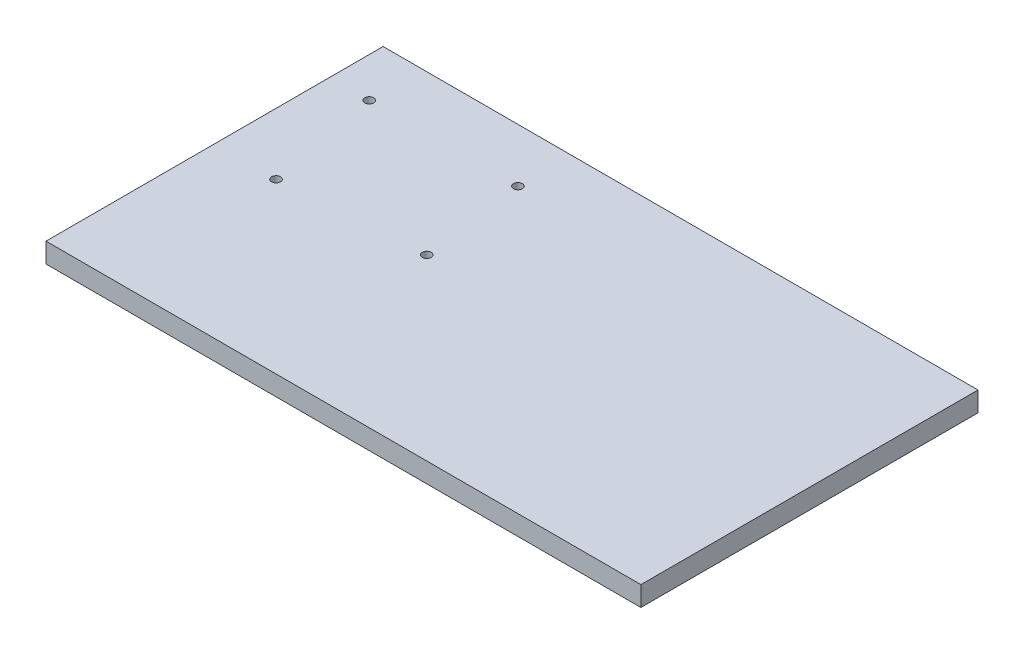
from build123d import *

# Parameters (mm, degrees)
SKETCH_1_W      = 300
SKETCH_1_H      = 170
SKETCH_1_R      = 2.25
EXTRUDE_1_DEPTH = 10


with BuildPart() as part:
    # Эскиз1 → Бобышка-Вытянуть1 (new body)
    with BuildSketch(Plane(origin=(0, 0, 0), x_dir=(1, 0, 0), z_dir=(0, 1, 0))):
        with Locations((150, 85)):
            Rectangle(SKETCH_1_W, SKETCH_1_H)
        with Locations(Location((20, 143, 0), (0, 0, 270))):
            Circle(SKETCH_1_R, mode=Mode.SUBTRACT)
        with Locations(Location((95, 143, 0), (0, 0, 270))):
            Circle(SKETCH_1_R, mode=Mode.SUBTRACT)
        with Locations(Location((102, 90, 0), (0, 0, 270))):
            Circle(SKETCH_1_R, mode=Mode.SUBTRACT)
        with Locations(Location((31, 84.997773958, 0), (0, 0, 270))):
            Circle(SKETCH_1_R, mode=Mode.SUBTRACT)
    extrude(amount=EXTRUDE_1_DEPTH)


solid = part.part
